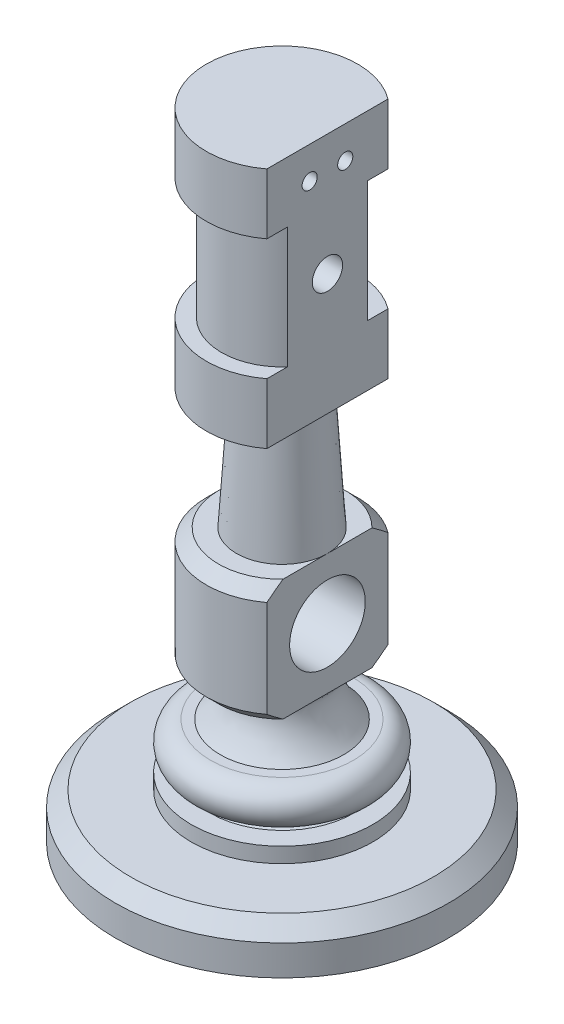
from build123d import *

# Parameters (mm, degrees)
CHAMFER1_SIZE                  = 1.5875
CHAMFER2_SIZE                  = 1.27
CUT_EXTRUDE4_REACH             = 73.102
SKETCH2_R                      = 3.96875
SKETCH2_R_2                    = 1.5875
SKETCH2_R_3                    = 0.79375
CUT_EXTRUDE4_DIRECTION_2_REACH = 73.102
CUT_EXTRUDE5_REACH             = 73.102
CUT_EXTRUDE5_END_RADIUS        = 6.35
SKETCH3_R                      = 3.175
CUT_EXTRUDE7_START             = -50.8
CUT_EXTRUDE7_DEPTH             = 50.8


with BuildPart() as part:
    # Sketch1 → Revolve1 (revolve)
    with BuildSketch(Plane(origin=(0, 0, 0), x_dir=(0, 0, -1), z_dir=(1, 0, 0))):
        Polygon((0, 41.275), (0, 66.675), (-7.9375, 66.675), (-7.9375, 60.325), (-6.35, 60.325), (-6.35, 47.625), (-7.9375, 47.625), (-7.9375, 41.275), (-3.96875, 41.275), align=None)
        Polygon((0, 28.575), (0, 41.275), (-3.96875, 41.275), (-4.7625, 28.575), align=None)
        Polygon((0, 15.875), (0, 28.575), (-4.7625, 28.575), (-7.9375, 28.575), (-7.9375, 15.875), (-7.493, 15.875), (-4.7625, 15.875), align=None)
        with BuildLine():
            Line((0, 11.165242708), (0, 15.875))
            Line((0, 15.875), (-4.7625, 15.875))
            add(Edge.make_bspline(
                [(-4.7625, 15.875), (-4.599205469, 15.673771419), (-4.529160375, 15.219340562), (-4.601951333, 14.659365635), (-4.863719246, 13.209599289), (-5.693032567, 11.944502432), (-6.477, 11.165242708)],
                knots=[0, 0, 0, 0, 0.134423487, 0.277975298, 0.329406914, 1, 1, 1, 1], degree=3))
            Line((-6.477, 11.165242708), (0, 11.165242708))
        make_face()
        with BuildLine():
            Line((0, 6.35), (0, 11.165242708))
            Line((0, 11.165242708), (-6.477, 11.165242708))
            Line((-6.477, 11.165242708), (-7.493, 11.165242708))
            ThreePointArc((-7.493, 11.165242708), (-9.525, 9.133242708), (-7.493, 7.101242708))
            ThreePointArc((-7.493, 7.101242708), (-7.21765082, 6.725621354), (-7.493, 6.35))
            Line((-7.493, 6.35), (0, 6.35))
        make_face()
        Polygon((0, 4.7625), (0, 6.35), (-7.493, 6.35), (-9.525, 6.35), (-9.525, 4.7625), align=None)
        Polygon((0, 0), (0, 4.7625), (-9.525, 4.7625), (-17.4625, 4.7625), (-17.4625, 0), align=None)
    revolve(axis=Axis((0, 73.617342774, 0), (0, -1, 0)))

    # Chamfer1
    chamfer1_edges = [part.edges().sort_by_distance(p)[0] for p in [
        (0, 4.7625, -17.4625),
    ]]
    chamfer(chamfer1_edges, length=CHAMFER1_SIZE)

    # Chamfer2
    chamfer2_edges = [part.edges().sort_by_distance(p)[0] for p in [
        (0, 15.875, -7.9375),
        (0, 28.575, -7.9375),
    ]]
    chamfer(chamfer2_edges, length=CHAMFER2_SIZE)

    # Sketch2 → Cut-Extrude4 (cut, up to next)
    with BuildSketch(Plane(origin=(0, 0, 0), x_dir=(0, 0, -1), z_dir=(1, 0, 0)), mode=Mode.PRIVATE) as cut_extrude4_sk1:
        with Locations(Location((0, 22.225, 0), (0, 0, 180))):
            Circle(SKETCH2_R)
    cut_extrude4_tool1 = extrude(cut_extrude4_sk1.sketch, amount=-CUT_EXTRUDE4_REACH, mode=Mode.PRIVATE) & part.part
    # Sketch2 → Cut-Extrude4 (cut, up to next)
    with BuildSketch(Plane(origin=(0, 0, 0), x_dir=(0, 0, -1), z_dir=(1, 0, 0)), mode=Mode.PRIVATE) as cut_extrude4_sk2:
        with Locations(Location((0, 53.975, 0), (0, 0, 180))):
            Circle(SKETCH2_R_2)
    cut_extrude4_tool2 = extrude(cut_extrude4_sk2.sketch, amount=-CUT_EXTRUDE4_REACH, mode=Mode.PRIVATE) & part.part
    # Sketch2 → Cut-Extrude4 (cut, up to next)
    with BuildSketch(Plane(origin=(0, 0, 0), x_dir=(0, 0, -1), z_dir=(1, 0, 0)), mode=Mode.PRIVATE) as cut_extrude4_sk3:
        with Locations(Location((-1.864995, 63.307976, 0), (0, 0, 180))):
            Circle(SKETCH2_R_3)
    cut_extrude4_tool3 = extrude(cut_extrude4_sk3.sketch, amount=-CUT_EXTRUDE4_REACH, mode=Mode.PRIVATE) & part.part
    # Sketch2 → Cut-Extrude4 (cut, up to next)
    with BuildSketch(Plane(origin=(0, 0, 0), x_dir=(0, 0, -1), z_dir=(1, 0, 0)), mode=Mode.PRIVATE) as cut_extrude4_sk4:
        with Locations(Location((1.864995, 63.307976, 0), (0, 0, 180))):
            Circle(SKETCH2_R_3)
    cut_extrude4_tool4 = extrude(cut_extrude4_sk4.sketch, amount=-CUT_EXTRUDE4_REACH, mode=Mode.PRIVATE) & part.part
    add(cut_extrude4_tool1.solids().sort_by_distance((0, 22.225, 0))[0], mode=Mode.SUBTRACT)
    add(cut_extrude4_tool2.solids().sort_by_distance((0, 53.975, 0))[0], mode=Mode.SUBTRACT)
    add(cut_extrude4_tool3.solids().sort_by_distance((0, 63.307976, 1.864995))[0], mode=Mode.SUBTRACT)
    add(cut_extrude4_tool4.solids().sort_by_distance((0, 63.307976, -1.864995))[0], mode=Mode.SUBTRACT)

    # Sketch2 → Cut-Extrude4 direction 2 (cut, up to next)
    with BuildSketch(Plane(origin=(0, 0, 0), x_dir=(0, 0, -1), z_dir=(1, 0, 0)), mode=Mode.PRIVATE) as cut_extrude4_direction_2_sk1:
        with Locations(Location((0, 22.225, 0), (0, 0, 180))):
            Circle(SKETCH2_R)
    cut_extrude4_direction_2_tool1 = extrude(cut_extrude4_direction_2_sk1.sketch, amount=CUT_EXTRUDE4_DIRECTION_2_REACH, mode=Mode.PRIVATE) & part.part
    # Sketch2 → Cut-Extrude4 direction 2 (cut, up to next)
    with BuildSketch(Plane(origin=(0, 0, 0), x_dir=(0, 0, -1), z_dir=(1, 0, 0)), mode=Mode.PRIVATE) as cut_extrude4_direction_2_sk2:
        with Locations(Location((0, 53.975, 0), (0, 0, 180))):
            Circle(SKETCH2_R_2)
    cut_extrude4_direction_2_tool2 = extrude(cut_extrude4_direction_2_sk2.sketch, amount=CUT_EXTRUDE4_DIRECTION_2_REACH, mode=Mode.PRIVATE) & part.part
    # Sketch2 → Cut-Extrude4 direction 2 (cut, up to next)
    with BuildSketch(Plane(origin=(0, 0, 0), x_dir=(0, 0, -1), z_dir=(1, 0, 0)), mode=Mode.PRIVATE) as cut_extrude4_direction_2_sk3:
        with Locations(Location((-1.864995, 63.307976, 0), (0, 0, 180))):
            Circle(SKETCH2_R_3)
    cut_extrude4_direction_2_tool3 = extrude(cut_extrude4_direction_2_sk3.sketch, amount=CUT_EXTRUDE4_DIRECTION_2_REACH, mode=Mode.PRIVATE) & part.part
    # Sketch2 → Cut-Extrude4 direction 2 (cut, up to next)
    with BuildSketch(Plane(origin=(0, 0, 0), x_dir=(0, 0, -1), z_dir=(1, 0, 0)), mode=Mode.PRIVATE) as cut_extrude4_direction_2_sk4:
        with Locations(Location((1.864995, 63.307976, 0), (0, 0, 180))):
            Circle(SKETCH2_R_3)
    cut_extrude4_direction_2_tool4 = extrude(cut_extrude4_direction_2_sk4.sketch, amount=CUT_EXTRUDE4_DIRECTION_2_REACH, mode=Mode.PRIVATE) & part.part
    add(cut_extrude4_direction_2_tool1.solids().sort_by_distance((0, 22.225, 0))[0], mode=Mode.SUBTRACT)
    add(cut_extrude4_direction_2_tool2.solids().sort_by_distance((0, 53.975, 0))[0], mode=Mode.SUBTRACT)
    add(cut_extrude4_direction_2_tool3.solids().sort_by_distance((0, 63.307976, 1.864995))[0], mode=Mode.SUBTRACT)
    add(cut_extrude4_direction_2_tool4.solids().sort_by_distance((0, 63.307976, -1.864995))[0], mode=Mode.SUBTRACT)

    # Cut-Extrude5: up to this cylinder (the profile starts inside it)
    cut_extrude5_end = Plane(origin=(0, 53.975, 0), z_dir=(0, 1, 0)) * Cylinder(CUT_EXTRUDE5_END_RADIUS, 159.904, mode=Mode.PRIVATE)
    # Sketch3 → Cut-Extrude5 (cut, up to the surface)
    with BuildSketch(Plane(origin=(0, 0, 0), x_dir=(0, 0, -1), z_dir=(1, 0, 0)), mode=Mode.PRIVATE) as cut_extrude5_sk1:
        with Locations((0, 53.975)):
            Circle(SKETCH3_R)
    cut_extrude5_tool1 = extrude(cut_extrude5_sk1.sketch, amount=-CUT_EXTRUDE5_REACH, mode=Mode.PRIVATE) & cut_extrude5_end
    add(cut_extrude5_tool1.solids().sort_by_distance((0, 53.975, 0))[0], mode=Mode.SUBTRACT)

    # Sketch5 → Cut-Extrude7 (cut)
    with BuildSketch(Plane(origin=(0, 66.675, 0), x_dir=(1, 0, 0), z_dir=(0, 1, 0)).offset(CUT_EXTRUDE7_START)):
        with BuildLine():
            Line((4.7625, 10.702126501), (4.7625, 6.35))
            ThreePointArc((4.7625, 6.35), (7.099515829, 3.549757914), (7.9375, 0))
            Line((7.9375, 0), (7.9375, 10.702126501))
            Line((7.9375, 10.702126501), (4.7625, 10.702126501))
        make_face()
        with BuildLine():
            ThreePointArc((7.9375, 0), (7.099515829, 3.549757914), (4.7625, 6.35))
            Line((4.7625, 6.35), (4.7625, -6.35))
            ThreePointArc((4.7625, -6.35), (7.099515829, -3.549757914), (7.9375, 0))
        make_face()
        with BuildLine():
            ThreePointArc((7.9375, 0), (7.099515829, -3.549757914), (4.7625, -6.35))
            Line((4.7625, -6.35), (4.7625, -10.274895902))
            Line((4.7625, -10.274895902), (7.9375, -10.274895902))
            Line((7.9375, -10.274895902), (7.9375, 0))
        make_face()
    extrude(amount=CUT_EXTRUDE7_DEPTH, mode=Mode.SUBTRACT)


solid = part.part
